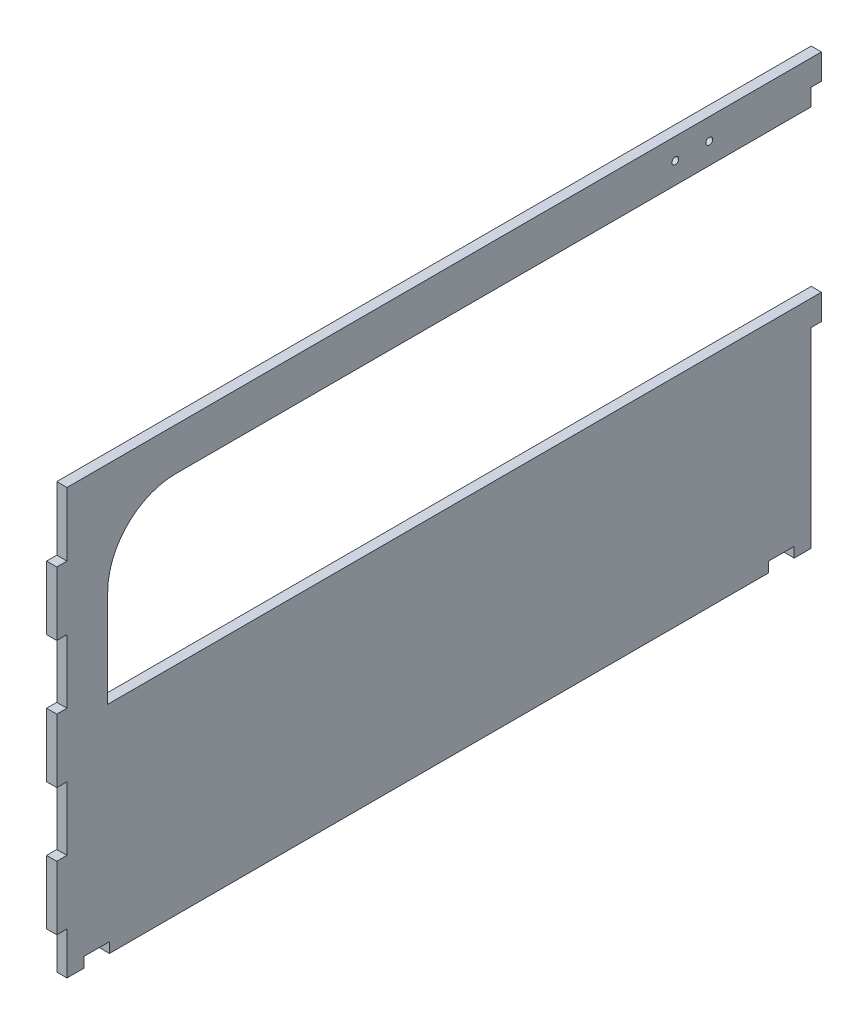
from build123d import *

# Parameters (mm, degrees)
BOSS_EXTRUDE1_DEPTH = 6
SKETCH2_W           = 6
SKETCH2_H           = 37.5
CUT_EXTRUDE1_DEPTH  = 6
LPATTERN1_COUNT     = 4
LPATTERN1_PITCH     = 75
FILLET1_R           = 40
SKETCH3_W           = 6
SKETCH3_H           = 10
SKETCH3_H_2         = 112.5
CUT_EXTRUDE2_DEPTH  = 515.816472153
SKETCH4_W           = 15
SKETCH4_H           = 6
CUT_EXTRUDE3_DEPTH  = 515.816472153
SKETCH5_R           = 2
CUT_EXTRUDE4_DEPTH  = 515.816472153


with BuildPart() as part:
    # Sketch1 → Boss-Extrude1 (new body)
    with BuildSketch(Plane(origin=(0, 0, 0), x_dir=(0, 0, -1), z_dir=(1, 0, 0))):
        Polygon((450, 225), (450, 250), (0, 250), (0, 0), (450, 0), (450, 127.5), (30, 127.5), (30, 225), align=None)
    extrude(amount=BOSS_EXTRUDE1_DEPTH)

    # Sketch2 → Cut-Extrude1 (cut)
    with BuildSketch(Plane(origin=(6, 0, 0), x_dir=(0, 0, -1), z_dir=(1, 0, 0))):
        with Locations((3, 231.25)):
            Rectangle(SKETCH2_W, SKETCH2_H)
    cut_extrude1 = extrude(amount=-CUT_EXTRUDE1_DEPTH, mode=Mode.SUBTRACT)

    # LPattern1: Cut-Extrude1 ×4
    with Locations(*[(0, -i * LPATTERN1_PITCH, 0) for i in range(1, LPATTERN1_COUNT)]):
        add(cut_extrude1, mode=Mode.SUBTRACT)

    # Fillet1
    fillet1_edges = [part.edges().sort_by_distance(p)[0] for p in [
        (3, 225, -30),
    ]]
    fillet(fillet1_edges, radius=FILLET1_R)

    # Sketch3 → Cut-Extrude2 (cut, through all)
    with BuildSketch(Plane.ZY):
        with Locations((-447, 230)):
            Rectangle(SKETCH3_W, SKETCH3_H)
        with Locations((-447, 56.25)):
            Rectangle(SKETCH3_W, SKETCH3_H_2)
    extrude(amount=-CUT_EXTRUDE2_DEPTH, mode=Mode.SUBTRACT)

    # Sketch4 → Cut-Extrude3 (cut, through all)
    with BuildSketch(Plane.ZY):
        with Locations((-23.5, 3)):
            Rectangle(SKETCH4_W, SKETCH4_H)
        with Locations((-426.5, 3)):
            Rectangle(SKETCH4_W, SKETCH4_H)
    extrude(amount=-CUT_EXTRUDE3_DEPTH, mode=Mode.SUBTRACT)

    # Sketch5 → Cut-Extrude4 (cut, through all)
    with BuildSketch(Plane.ZY):
        with Locations((-384, 237.5)):
            Circle(SKETCH5_R)
        with Locations((-364, 237.5)):
            Circle(SKETCH5_R)
    extrude(amount=-CUT_EXTRUDE4_DEPTH, mode=Mode.SUBTRACT)


solid = part.part
